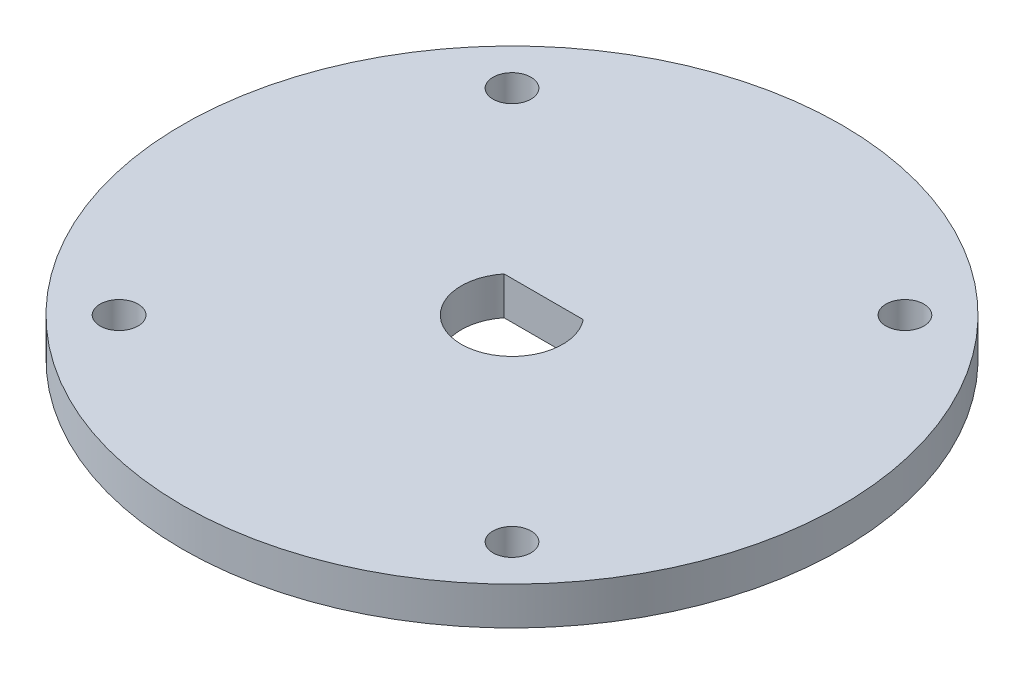
from build123d import *

# Parameters (mm, degrees)
SKETCH_1_R      = 26
SKETCH_1_R_2    = 1.5
EXTRUDE_1_DEPTH = 3


with BuildPart() as part:
    # Эскиз1 → Бобышка-Вытянуть1 (new body)
    with BuildSketch(Plane(origin=(0, 0, 0), x_dir=(1, 0, 0), z_dir=(0, 1, 0))):
        with Locations(Location((-42.952158514, 15.778810529, 0), (0, 0, 270))):
            Circle(SKETCH_1_R)
        with Locations(Location((-58.452158514, 31.278810529, 0), (0, 0, 270))):
            Circle(SKETCH_1_R_2, mode=Mode.SUBTRACT)
        with Locations(Location((-58.452158514, 0.278810529, 0), (0, 0, 270))):
            Circle(SKETCH_1_R_2, mode=Mode.SUBTRACT)
        with Locations(Location((-27.452158514, 31.278810529, 0), (0, 0, 270))):
            Circle(SKETCH_1_R_2, mode=Mode.SUBTRACT)
        with Locations(Location((-27.452158514, 0.278810529, 0), (0, 0, 270))):
            Circle(SKETCH_1_R_2, mode=Mode.SUBTRACT)
        with BuildLine():
            Line((-46.074657514, 18.278810529), (-39.829659515, 18.278810529))
            ThreePointArc((-39.829659515, 18.278810529), (-42.952158514, 11.778810529), (-46.074657514, 18.278810529))
        make_face(mode=Mode.SUBTRACT)
    extrude(amount=EXTRUDE_1_DEPTH)


solid = part.part
